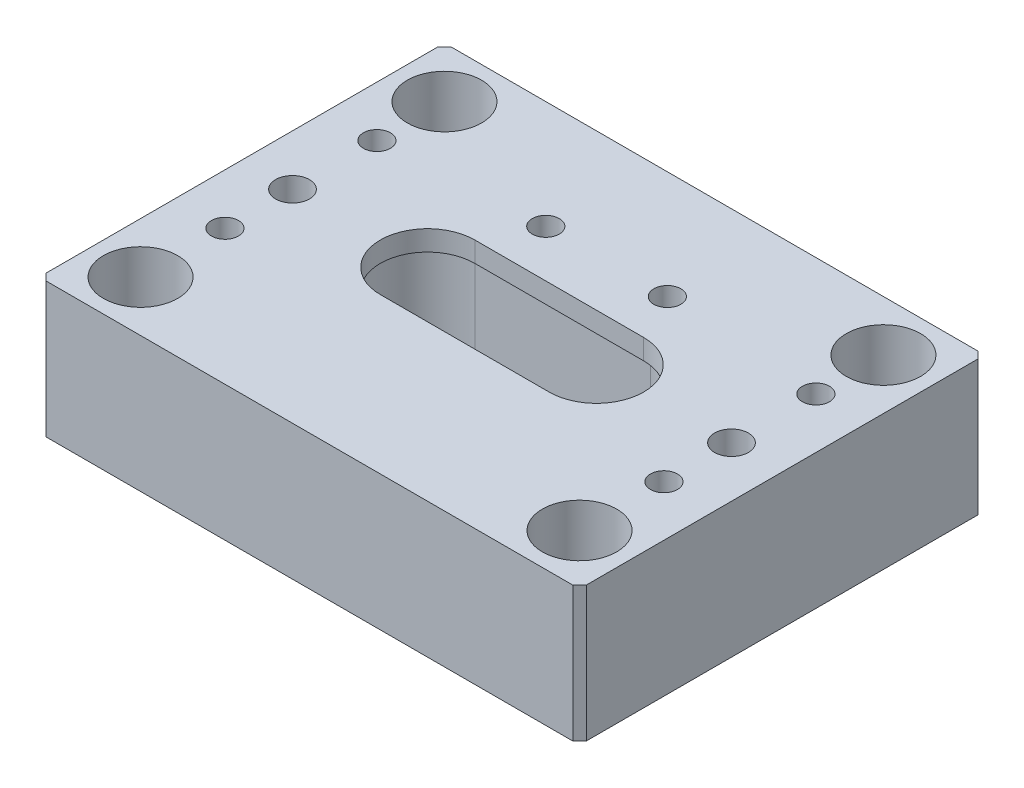
from build123d import *

# Parameters (mm, degrees)
BOSS_EXTRUDE1_DEPTH                              = 20
CUT_EXTRUDE1_DEPTH                               = 3
CUT_EXTRUDE3_DEPTH                               = 17
F_4_0MM_DOWEL_HOLE1_D                            = 4
F_4_0MM_DOWEL_HOLE1_DEPTH                        = 10
F_4_0MM_DOWEL_HOLE1_TIP                          = 1.201721238
M6X1_0_TAPPED_HOLE1_D                            = 5
CBORE_FOR_M5_HEX_HEAD_MACHINE_SCREW1_D           = 6.6
CBORE_FOR_M5_HEX_HEAD_MACHINE_SCREW1_CBORE_D     = 11
CBORE_FOR_M5_HEX_HEAD_MACHINE_SCREW1_CBORE_DEPTH = 10
F_4_0MM_DOWEL_HOLE2_D                            = 4


with BuildPart() as part:
    # Sketch1 → Boss-Extrude1 (new body)
    with BuildSketch(Plane(origin=(0, 0, 0), x_dir=(1, 0, 0), z_dir=(0, 1, 0))):
        Polygon((39, 30), (40, 29), (40, -29), (39, -30), (-39, -30), (-40, -29), (-40, 29), (-39, 30), align=None)
    extrude(amount=BOSS_EXTRUDE1_DEPTH)

    # Sketch2 → Cut-Extrude1 (cut)
    with BuildSketch(Plane(origin=(0, 20, 0), x_dir=(1, 0, 0), z_dir=(0, 1, 0))):
        with BuildLine():
            Line((-12.5, 7), (12.5, 7))
            ThreePointArc((12.5, 7), (19.5, 0), (12.5, -7))
            Line((12.5, -7), (-12.5, -7))
            ThreePointArc((-12.5, -7), (-19.5, 0), (-12.5, 7))
        make_face()
    extrude(amount=-CUT_EXTRUDE1_DEPTH, mode=Mode.SUBTRACT)

    # Sketch3 → Cut-Extrude3 (cut)
    with BuildSketch(Plane(origin=(0, 0, 0), x_dir=(-1, 0, 0), z_dir=(0, -1, 0))):
        with BuildLine():
            Line((13, -7.5), (-13, -7.5))
            ThreePointArc((-13, -7.5), (-20.5, 0), (-13, 7.5))
            Line((-13, 7.5), (13, 7.5))
            ThreePointArc((13, 7.5), (20.5, 0), (13, -7.5))
        make_face()
    extrude(amount=-CUT_EXTRUDE3_DEPTH, mode=Mode.SUBTRACT)

    # Ø4.0mm Dowel Hole1
    with Locations(Plane(origin=(0, 20, 0), x_dir=(1, 0, 0), z_dir=(0, 1, 0))):
        with Locations((9, 14), (-9, 14)):
            Hole(F_4_0MM_DOWEL_HOLE1_D / 2, depth=F_4_0MM_DOWEL_HOLE1_DEPTH)
            with Locations((0, 0, -(F_4_0MM_DOWEL_HOLE1_DEPTH + F_4_0MM_DOWEL_HOLE1_TIP / 2))):  # 118° drill point
                Cone(0, F_4_0MM_DOWEL_HOLE1_D / 2, F_4_0MM_DOWEL_HOLE1_TIP, mode=Mode.SUBTRACT)

    # M6x1.0 Tapped Hole1 (through all)
    with Locations(Plane(origin=(0, 20, 0), x_dir=(1, 0, 0), z_dir=(0, 1, 0))):
        with Locations((-32.5, 0), (32.5, 0)):
            Hole(M6X1_0_TAPPED_HOLE1_D / 2)

    # CBORE for M5 Hex Head Machine Screw1 (through all)
    with Locations(Plane(origin=(0, 20, 0), x_dir=(1, 0, 0), z_dir=(0, 1, 0))):
        with Locations((-32.5, -22.5), (-32.5, 22.5), (32.5, 22.5), (32.5, -22.5)):
            CounterBoreHole(CBORE_FOR_M5_HEX_HEAD_MACHINE_SCREW1_D / 2, CBORE_FOR_M5_HEX_HEAD_MACHINE_SCREW1_CBORE_D / 2, CBORE_FOR_M5_HEX_HEAD_MACHINE_SCREW1_CBORE_DEPTH)

    # Ø4.0mm Dowel Hole2 (through all)
    with Locations(Plane(origin=(0, 20, 0), x_dir=(1, 0, 0), z_dir=(0, 1, 0))):
        with Locations((32.5, 12.5), (32.5, -10), (-32.5, -10), (-32.5, 12.5)):
            Hole(F_4_0MM_DOWEL_HOLE2_D / 2)


solid = part.part
